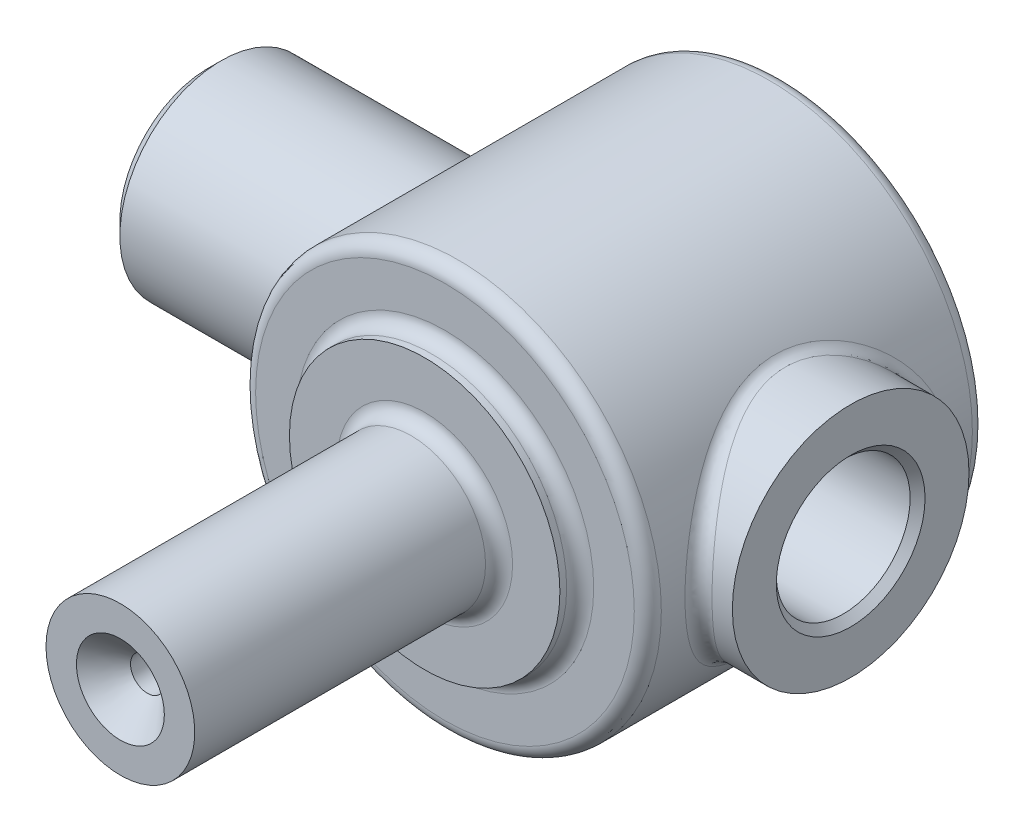
from build123d import *

# Parameters (mm, degrees)
SKETCH_1_R           = 30
EXTRUDE_1_DEPTH      = 50
SKETCH_2_R           = 20
EXTRUDE_2_DEPTH      = 3
SKETCH_3_R           = 11
EXTRUDE_3_DEPTH      = 45
EXTRUDE_4_DEPTH      = 35
EXTRUDE_4_DEPTH_BACK = 10
SKETCH_4_R           = 17.5
SKETCH_8_R           = 15
EXTRUDE_5_DEPTH      = 60
FILLET_1_R           = 2
CUT_EXTRUDE_1_REACH  = 141.746
SKETCH_7_R           = 9.8985
CHAMFER_1_SIZE       = 1.1015
CHAMFER_2_SIZE       = 1.921
CHAMFER_3_SIZE       = 0.828


with BuildPart() as part:
    # Эскиз1 → Бобышка-Вытянуть1 (new body)
    with BuildSketch(Plane.XY):
        Circle(SKETCH_1_R)
    extrude(amount=EXTRUDE_1_DEPTH)

    # Эскиз2 → Бобышка-Вытянуть2 (add)
    with BuildSketch(Plane.XY.offset(50)):
        Circle(SKETCH_2_R)
    extrude(amount=EXTRUDE_2_DEPTH)

    # Эскиз3 → Бобышка-Вытянуть3 (add)
    with BuildSketch(Plane.XY.offset(53)):
        with Locations(Location((0, 0, 0), (0, 0, 180))):
            Circle(SKETCH_3_R)
    extrude(amount=EXTRUDE_3_DEPTH)

    # Эскиз4 → Бобышка-Вытянуть4 (add, two sides: drawn at the far end of the back side and taken through both)
    with BuildSketch(Plane(origin=(0, 0, 0), x_dir=(0, 0, -1), z_dir=(1, 0, 0)).offset(-EXTRUDE_4_DEPTH_BACK)):
        with Locations((-25, 0)):
            Circle(SKETCH_4_R)
    extrude(amount=EXTRUDE_4_DEPTH + EXTRUDE_4_DEPTH_BACK)

    # Эскиз8 → Бобышка-Вытянуть5 (add)
    with BuildSketch(Plane(origin=(0, 0, 0), x_dir=(0, 0, -1), z_dir=(1, 0, 0))):
        with Locations((-25, 0)):
            Circle(SKETCH_8_R)
    extrude(amount=-EXTRUDE_5_DEPTH)

    # Эскиз5 → Вырез-Повернуть1 (revolve, cut)
    with BuildSketch(Plane(origin=(0, 0, 0), x_dir=(1, 0, 0), z_dir=(0, 1, 0))):
        Polygon((35, -25), (35, -34.5), (-15, -34.5), (-15, -32.172), (-40, -32.172), (-40, -36), (-60, -36), (-60, -25), align=None)
    revolve(axis=Axis((-60, 0, 25), (1, 0, 0)), mode=Mode.SUBTRACT)

    # Эскиз6 → Вырез-Повернуть2 (revolve, cut)
    with BuildSketch(Plane(origin=(0, 0, 0), x_dir=(1, 0, 0), z_dir=(0, 1, 0))):
        Polygon((6.5, -98), (2.5, -94), (2.5, -30), (0, -30), (0, -98), align=None)
    revolve(axis=Axis((0, 0, 98), (0, 0, -1)), mode=Mode.SUBTRACT)

    # Скругление1
    fillet_1_edges = [part.edges().sort_by_distance(p)[0] for p in [
        (11, 0, 53),
        (24.366985862, 17.5, 25),
        (-30, 0, 0),
        (-30, 0, 40),
        (-30, 0, 50),
        (-20, 0, 50),
    ]]
    fillet(fillet_1_edges, radius=FILLET_1_R)

    # Вырез-Вытянуть1: up to this face of the body (flat: up to its plane)
    cut_extrude_1_end = Plane(part.part.faces().sort_by_distance((-15, 0, 15.768700577))[0])
    # Эскиз7 → Вырез-Вытянуть1 (cut, up to the picked face)
    with BuildSketch(Plane(origin=(35, 0, 0), x_dir=(0, 0, -1), z_dir=(1, 0, 0)), mode=Mode.PRIVATE) as cut_extrude_1_sk1:
        with Locations((-25, 0)):
            Circle(SKETCH_7_R)
    cut_extrude_1_tool1 = split(extrude(cut_extrude_1_sk1.sketch, amount=-CUT_EXTRUDE_1_REACH, mode=Mode.PRIVATE), bisect_by=cut_extrude_1_end, keep=Keep.BOTH, mode=Mode.PRIVATE)
    add(cut_extrude_1_tool1.solids().sort_by(Axis((35, 0, 25), (-1, 0, 0)))[0], mode=Mode.SUBTRACT)

    # Фаска1
    chamfer_1_edges = [part.edges().sort_by_distance(p)[0] for p in [
        (35, 0, 34.8985),
    ]]
    chamfer(chamfer_1_edges, length=CHAMFER_1_SIZE)

    # Фаска2
    chamfer_2_edges = [part.edges().sort_by_distance(p)[0] for p in [
        (-60, 0, 40),
    ]]
    chamfer(chamfer_2_edges, length=CHAMFER_2_SIZE)

    # Фаска3
    chamfer_3_edges = [part.edges().sort_by_distance(p)[0] for p in [
        (-40, 0, 17.828),
    ]]
    chamfer(chamfer_3_edges, length=CHAMFER_3_SIZE)


solid = part.part
